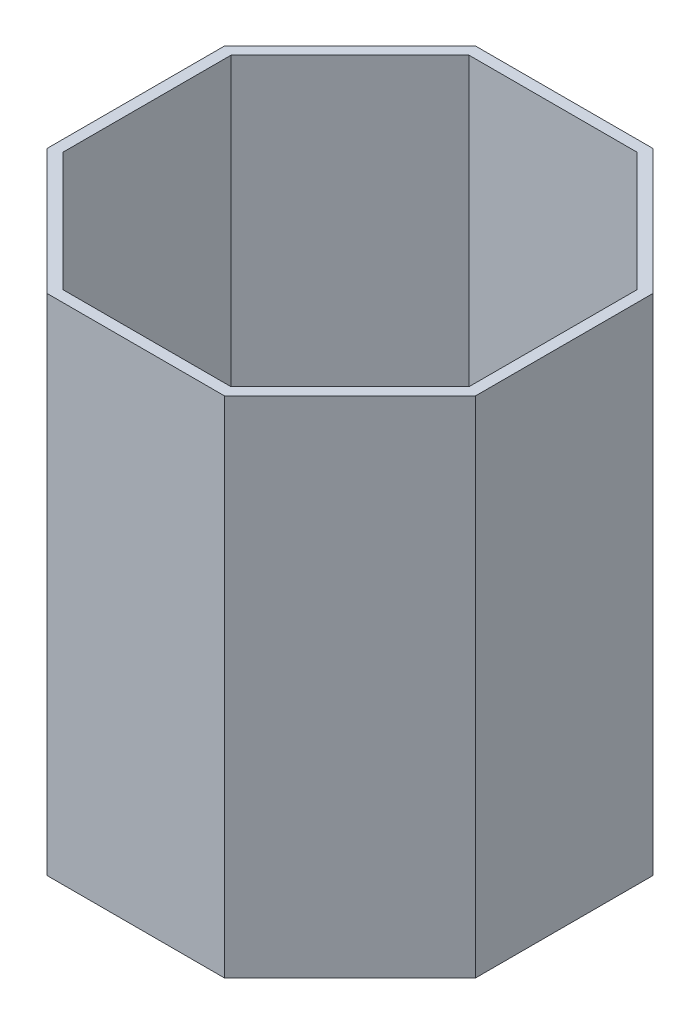
from build123d import *

# Parameters (mm, degrees)
BOSS_EXTRUDE4_DEPTH = 180


with BuildPart() as part:
    # Sketch2 → Boss-Extrude4 (new body)
    with BuildSketch(Plane(origin=(0, 0, 0), x_dir=(1, 0, 0), z_dir=(0, 1, 0))):
        Polygon((-76.5, 31.687337522), (-76.5, -31.687337522), (-31.687337522, -76.5), (31.687337522, -76.5), (76.5, -31.687337522), (76.5, 31.687337522), (31.687337522, 76.5), (-31.687337522, 76.5), align=None)
        Polygon((-72.5, -30.030483272), (-30.030483272, -72.5), (30.030483272, -72.5), (72.5, -30.030483272), (72.5, 30.030483272), (30.030483272, 72.5), (-30.030483272, 72.5), (-72.5, 30.030483272), align=None, mode=Mode.SUBTRACT)
    extrude(amount=BOSS_EXTRUDE4_DEPTH)


solid = part.part
